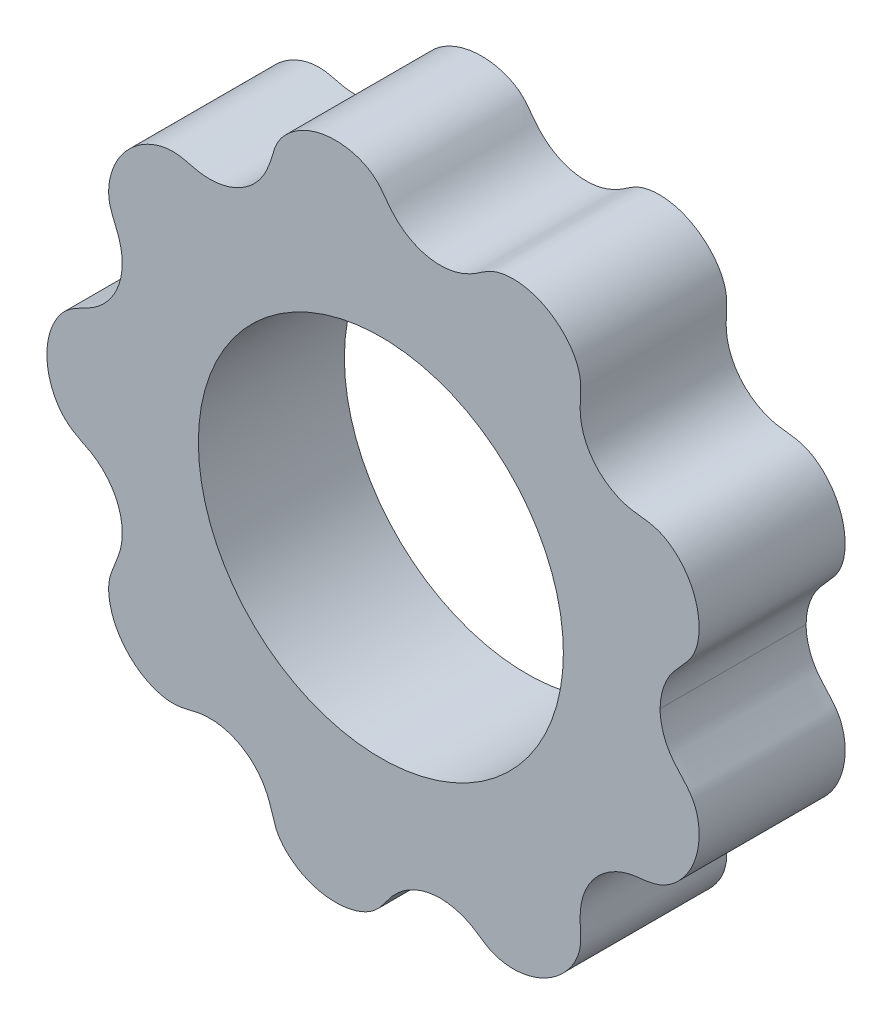
from build123d import *

# Parameters (mm, degrees)
ESQUISSE1_R        = 5
BOSS_EXTRU_4_DEPTH = 4


with BuildPart() as part:
    # Esquisse1 → Boss.-Extru.4 (new body)
    with BuildSketch(Plane.XY):
        with BuildLine():
            add(Edge.make_bspline(
                [(7.65, 0), (7.65, 0.340806275), (7.809832637, 0.86986378), (8.297272463, 1.364642586), (8.671749197, 1.828030626), (8.783100225, 2.637649337), (8.530543161, 3.388779471), (8.140665171, 3.875630806), (7.762693, 4.1564655), (7.338291975, 4.287217022), (6.658898677, 4.318091071), (5.858435691, 4.75755249), (5.452973057, 5.566633338), (5.457248732, 6.269289598), (5.504683015, 6.879027111), (5.106669474, 7.587518159), (4.453338995, 8.036022547), (3.848016595, 8.191414773), (3.379369766, 8.189777535), (2.945901637, 8.058414665), (2.561755631, 7.75380191), (2.078259034, 7.542411794), (1.383002265, 7.462286483), (0.701116152, 7.705351487), (0.211382918, 8.211279407), (-0.129230721, 8.750229279), (-0.855193433, 9.077334897), (-1.651122631, 9.042360631), (-2.228637289, 8.801969348), (-2.601660996, 8.52150577), (-2.886564133, 8.15658521), (-2.993911927, 7.700569277), (-3.191280842, 7.211168704), (-3.638840629, 6.672834579), (-4.29855466, 6.377265415), (-5.001629961, 6.397084317), (-5.47664752, 6.553313269), (-5.924957522, 6.551220473), (-6.519984406, 6.355263353), (-7.008869524, 5.946325313), (-7.325824676, 5.406639393), (-7.457137864, 4.959616695), (-7.471844797, 4.490109756), (-7.301055166, 4.073881725), (-7.100079355, 3.588202089), (-7.065820228, 3.064721758), (-7.184058844, 2.552198363), (-7.453911319, 2.101633055), (-7.841381277, 1.746143577), (-8.314063384, 1.537309226), (-8.681850356, 1.289833072), (-9.041497219, 0.776058476), (-9.15, 0.306988491), (-9.15, 0)],
                knots=[0.066092855, 0.066092855, 0.066092855, 0.066092855, 0.093239718, 0.106813149, 0.12038658, 0.147533443, 0.174680306, 0.188253737, 0.201827168, 0.2154006, 0.228974031, 0.256120894, 0.283267756, 0.296841188, 0.310414619, 0.337561482, 0.364708344, 0.378281776, 0.391855207, 0.405428638, 0.41900207, 0.432575501, 0.446148932, 0.473295795, 0.486869226, 0.500442658, 0.52758952, 0.554736383, 0.568309814, 0.581883246, 0.595456677, 0.609030108, 0.622603539, 0.636176971, 0.663323833, 0.676897265, 0.690470696, 0.704044127, 0.717617559, 0.744764421, 0.758337853, 0.771911284, 0.785484715, 0.799058147, 0.812631578, 0.826205009, 0.839778441, 0.853351872, 0.866925303, 0.880498735, 0.894072166, 0.907645597, 0.93479246, 0.93479246, 0.93479246, 0.93479246], degree=3))
            add(Edge.make_bspline(
                [(-9.15, 0), (-9.15, -0.306988491), (-9.041497219, -0.776058476), (-8.681850356, -1.289833072), (-8.314063384, -1.537309226), (-7.841381277, -1.746143577), (-7.453911319, -2.101633055), (-7.184058844, -2.552198363), (-7.065820228, -3.064721758), (-7.100079355, -3.588202089), (-7.301055166, -4.073881725), (-7.471844797, -4.490109756), (-7.457137864, -4.959616695), (-7.325824676, -5.406639393), (-7.008869524, -5.946325313), (-6.519984406, -6.355263353), (-5.924957522, -6.551220473), (-5.47664752, -6.553313269), (-5.001629961, -6.397084317), (-4.29855466, -6.377265415), (-3.638840629, -6.672834579), (-3.191280842, -7.211168704), (-2.993911927, -7.700569277), (-2.886564133, -8.15658521), (-2.601660996, -8.52150577), (-2.228637289, -8.801969348), (-1.651122631, -9.042360631), (-0.855193433, -9.077334897), (-0.129230721, -8.750229279), (0.211382918, -8.211279407), (0.701116152, -7.705351487), (1.383002265, -7.462286483), (2.078259034, -7.542411794), (2.561755631, -7.75380191), (2.945901637, -8.058414665), (3.379369766, -8.189777535), (3.848016595, -8.191414773), (4.453338995, -8.036022547), (5.106669474, -7.587518159), (5.504683015, -6.879027111), (5.457248732, -6.269289598), (5.452973057, -5.566633338), (5.858435691, -4.75755249), (6.658898677, -4.318091071), (7.338291975, -4.287217022), (7.762693, -4.1564655), (8.140665171, -3.875630806), (8.530543161, -3.388779471), (8.783100225, -2.637649337), (8.671749197, -1.828030626), (8.297272463, -1.364642586), (7.809832637, -0.86986378), (7.65, -0.340806275), (7.65, 0)],
                knots=[0.066092855, 0.066092855, 0.066092855, 0.066092855, 0.093239718, 0.106813149, 0.12038658, 0.133960012, 0.147533443, 0.161106874, 0.174680306, 0.188253737, 0.201827168, 0.2154006, 0.228974031, 0.242547462, 0.256120894, 0.283267756, 0.296841188, 0.310414619, 0.32398805, 0.337561482, 0.364708344, 0.378281776, 0.391855207, 0.405428638, 0.41900207, 0.432575501, 0.446148932, 0.473295795, 0.500442658, 0.514016089, 0.52758952, 0.554736383, 0.568309814, 0.581883246, 0.595456677, 0.609030108, 0.622603539, 0.636176971, 0.663323833, 0.690470696, 0.704044127, 0.717617559, 0.744764421, 0.771911284, 0.785484715, 0.799058147, 0.812631578, 0.826205009, 0.853351872, 0.880498735, 0.894072166, 0.907645597, 0.93479246, 0.93479246, 0.93479246, 0.93479246], degree=3))
        make_face()
        Circle(ESQUISSE1_R, mode=Mode.SUBTRACT)
    extrude(amount=BOSS_EXTRU_4_DEPTH)


solid = part.part
